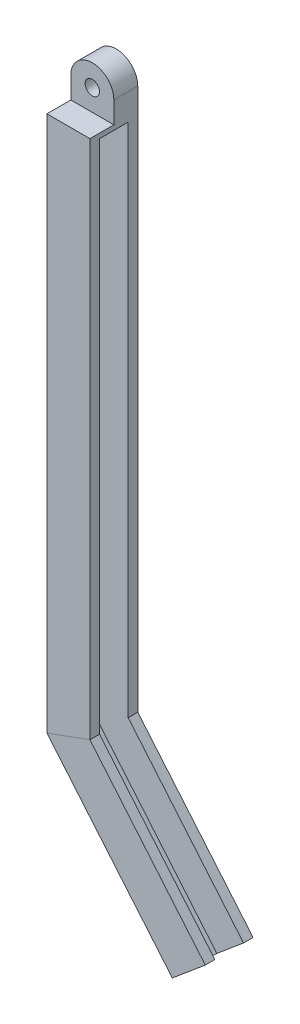
from build123d import *

# Parameters (mm, degrees)
SKETCH_4_W          = 9
SKETCH_4_H          = 10
EXTRUDE_2_DEPTH     = 10
CUT_EXTRUDE_1_DEPTH = 10
SKETCH_4_2_W        = 9
SKETCH_4_2_H        = 10
CUT_EXTRUDE_START   = 10
CUT_EXTRUDE_2_DEPTH = 10
SKETCH_8_R          = 1.5
CUT_EXTRUDE_3_DEPTH = 10
SKETCH_9_W          = 7.29
SKETCH_9_H          = 6
CUT_EXTRUDE_5_DEPTH = 110
SKETCH_13_W         = 7.29
SKETCH_13_H         = 6
CUT_EXTRUDE_6_DEPTH = 40


with BuildPart() as part:
    # 草图4 → 凸台-拉伸2 (new body)
    with BuildSketch(Plane(origin=(0, 0, 0), x_dir=(1, 0, 0), z_dir=(0, 1, 0))):
        with Locations((-19.8, -3.957142857)):
            Rectangle(SKETCH_4_W, SKETCH_4_H)
    extrude(amount=EXTRUDE_2_DEPTH)

    # 草图6 → 切除-拉伸1 (cut)
    with BuildSketch(Plane.XY.offset(8.957142857)):
        with BuildLine():
            Line((-24.3, 10), (-24.3, 5))
            ThreePointArc((-24.3, 5), (-19.8, 9.5), (-15.3, 5))
            Line((-15.3, 5), (-15.3, 10))
            Line((-15.3, 10), (-24.3, 10))
        make_face()
    extrude(amount=-CUT_EXTRUDE_1_DEPTH, mode=Mode.SUBTRACT)

    # 扫描2: sweep along a path in 草图5
    with BuildLine(Plane.XY.offset(3.957142857)) as sweep_2_path:
        Line((-19.8, 0), (-19.8, -110))
        Line((-19.8, -110), (5.372988935, -140))
    # 草图4<2> → 扫描2 (sweep)
    with BuildSketch(Plane(origin=(0, 0, 0), x_dir=(1, 0, 0), z_dir=(0, 1, 0))):
        with Locations((-19.8, -3.957142857)):
            Rectangle(SKETCH_4_2_W, SKETCH_4_2_H)
    sweep(path=sweep_2_path.line, transition=Transition.RIGHT)

    # 草图7 → 切除-拉伸2 (cut)
    with BuildSketch(Plane.XY.offset(3.957142857).offset(CUT_EXTRUDE_START)):
        with BuildLine():
            Line((-24.3, 5), (-24.3, 0.5))
            Line((-24.3, 0.5), (-15.3, 0.5))
            Line((-15.3, 0.5), (-15.3, 5))
            ThreePointArc((-15.3, 5), (-19.8, 9.5), (-24.3, 5))
        make_face()
    extrude(amount=-CUT_EXTRUDE_2_DEPTH, mode=Mode.SUBTRACT)

    # 草图8 → 切除-拉伸3 (cut)
    with BuildSketch(Plane.XY.offset(3.957142857)):
        with Locations((-19.8, 5)):
            Circle(SKETCH_8_R)
    extrude(amount=-CUT_EXTRUDE_3_DEPTH, mode=Mode.SUBTRACT)

    # 草图9 → 切除-拉伸5 (cut)
    with BuildSketch(Plane(origin=(0, -0.5, 0), x_dir=(1, 0, 0), z_dir=(0, 1, 0))):
        with Locations((-18.945, -3.957142857)):
            Rectangle(SKETCH_9_W, SKETCH_9_H)
    extrude(amount=-CUT_EXTRUDE_5_DEPTH, mode=Mode.SUBTRACT)

    # 草图13 → 切除-拉伸6 (cut)
    with BuildSketch(Plane(origin=(71.15653231, -84.801053017, 0), x_dir=(0.7660444431189772, 0.6427876096865404, 0), z_dir=(0.6427876096865403, -0.7660444431189771, 0))):
        with Locations((-85.019317039, 3.957142857)):
            Rectangle(SKETCH_13_W, SKETCH_13_H)
    extrude(amount=-CUT_EXTRUDE_6_DEPTH, mode=Mode.SUBTRACT)


solid = part.part
